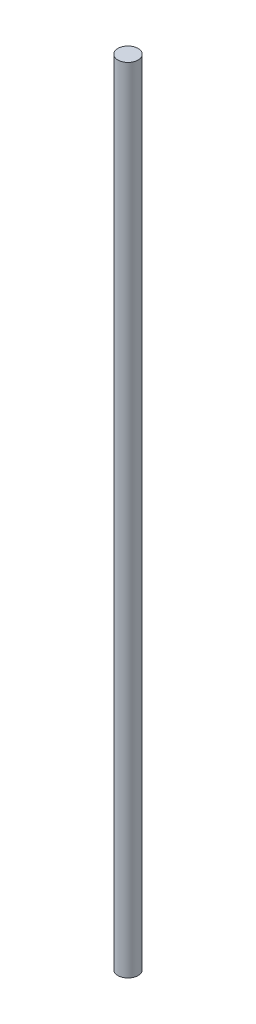
from build123d import *

# Parameters (mm, degrees)
SKETCH1_R           = 4
BOSS_EXTRUDE1_DEPTH = 315


with BuildPart() as part:
    # Sketch1 → Boss-Extrude1 (new body)
    with BuildSketch(Plane(origin=(0, 0, 0), x_dir=(1, 0, 0), z_dir=(0, 1, 0))):
        with Locations(Location((0, 0, 0), (0, 0, 270))):
            Circle(SKETCH1_R)
    extrude(amount=BOSS_EXTRUDE1_DEPTH)


solid = part.part
